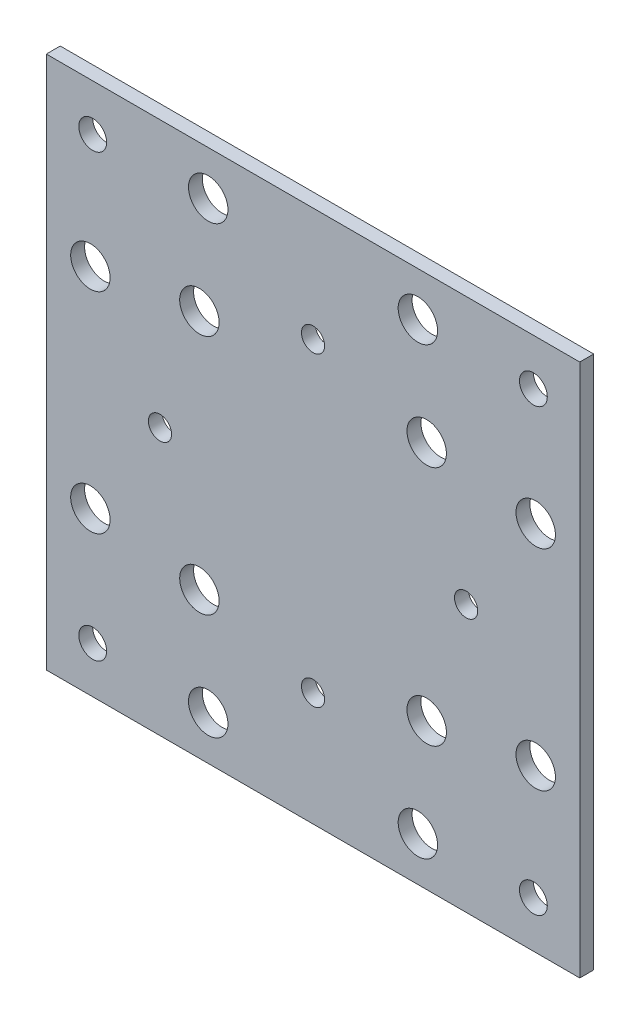
from build123d import *

# Parameters (mm, degrees)
SKETCH_1_W          = 115
SKETCH_1_H          = 115
EXTRUDE_1_DEPTH     = 3
SKETCH_3_R          = 3
CUT_EXTRUDE_2_DEPTH = 82.372599811
SKETCH_4_R          = 4.25
SKETCH_4_R_2        = 2.5
CUT_EXTRUDE_3_DEPTH = 3
SKETCH_5_R          = 4.25
CUT_EXTRUDE_4_DEPTH = 3


with BuildPart() as part:
    # 草图1 → 凸台-拉伸1 (new body)
    with BuildSketch(Plane.XY):
        Rectangle(SKETCH_1_W, SKETCH_1_H)
    extrude(amount=EXTRUDE_1_DEPTH)

    # 草图3 → 切除-拉伸2 (cut, through all)
    with BuildSketch(Plane.XY.offset(3)):
        with Locations((-47.5, 47.5)):
            Circle(SKETCH_3_R)
        with Locations((47.5, 47.5)):
            Circle(SKETCH_3_R)
        with Locations((47.5, -47.5)):
            Circle(SKETCH_3_R)
        with Locations((-47.5, -47.5)):
            Circle(SKETCH_3_R)
    extrude(amount=-CUT_EXTRUDE_2_DEPTH, mode=Mode.SUBTRACT)

    # 草图4 → 切除-拉伸3 (cut)
    with BuildSketch(Plane.XY.offset(3)):
        with Locations((-22.6, -48)):
            Circle(SKETCH_4_R)
        with Locations((22.6, -48)):
            Circle(SKETCH_4_R)
        with Locations((-48, -22.6)):
            Circle(SKETCH_4_R)
        with Locations((-48, 22.6)):
            Circle(SKETCH_4_R)
        with Locations((48, -22.6)):
            Circle(SKETCH_4_R)
        with Locations((48, 22.6)):
            Circle(SKETCH_4_R)
        with Locations((22.6, 48)):
            Circle(SKETCH_4_R)
        with Locations((-22.6, 48)):
            Circle(SKETCH_4_R)
        with Locations((-33, 0)):
            Circle(SKETCH_4_R_2)
        with Locations((0, -33)):
            Circle(SKETCH_4_R_2)
        with Locations((0, 33)):
            Circle(SKETCH_4_R_2)
        with Locations((33, 0)):
            Circle(SKETCH_4_R_2)
    extrude(amount=-CUT_EXTRUDE_3_DEPTH, mode=Mode.SUBTRACT)

    # 草图5 → 切除-拉伸4 (cut)
    with BuildSketch(Plane.XY.offset(3)):
        with Locations((-24.5, 26)):
            Circle(SKETCH_5_R)
        with Locations(Location((-24.5, -26, 0), (0, 0, 180))):
            Circle(SKETCH_5_R)
        with Locations(Location((24.5, 26, 0), (0, 0, 180))):
            Circle(SKETCH_5_R)
        with Locations((24.5, -26)):
            Circle(SKETCH_5_R)
    extrude(amount=-CUT_EXTRUDE_4_DEPTH, mode=Mode.SUBTRACT)


solid = part.part
